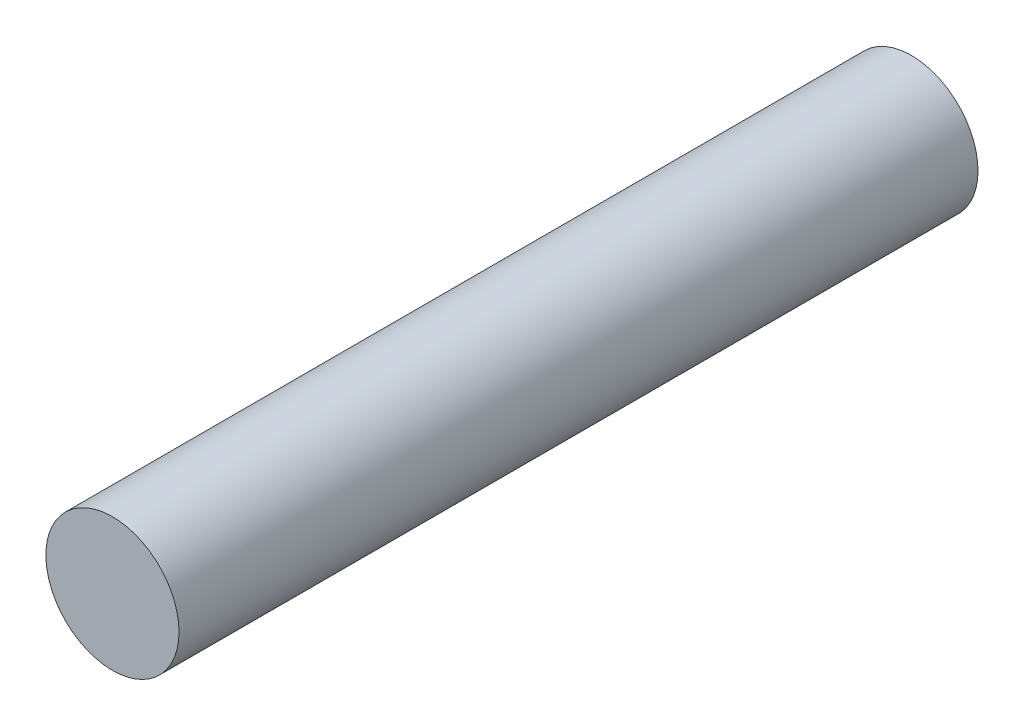
from build123d import *

# Parameters (mm, degrees)
SKETCH1_R           = 5
BOSS_EXTRUDE1_DEPTH = 60
SKETCH2_W           = 5
SKETCH2_H           = 4
CUT_EXTRUDE1_DEPTH  = 40
SKETCH4_R           = 2
CUT_EXTRUDE2_DEPTH  = 40


with BuildPart() as part:
    # Sketch1 → Boss-Extrude1 (new body)
    with BuildSketch(Plane.XY):
        Circle(SKETCH1_R)
    extrude(amount=BOSS_EXTRUDE1_DEPTH)

    # Sketch2 → Cut-Extrude1 (cut)
    with BuildSketch(Plane(origin=(0, 0, 0), x_dir=(-1, 0, 0), z_dir=(0, 0, -1))):
        Rectangle(SKETCH2_W, SKETCH2_H)
    extrude(amount=-CUT_EXTRUDE1_DEPTH, mode=Mode.SUBTRACT)

    # Sketch4 → Cut-Extrude2 (cut)
    with BuildSketch(Plane(origin=(0, 0, 0), x_dir=(0, 0, -1), z_dir=(1, 0, 0))):
        with Locations((-52, 0)):
            Circle(SKETCH4_R)
    extrude(amount=-CUT_EXTRUDE2_DEPTH, mode=Mode.SUBTRACT)


solid = part.part
